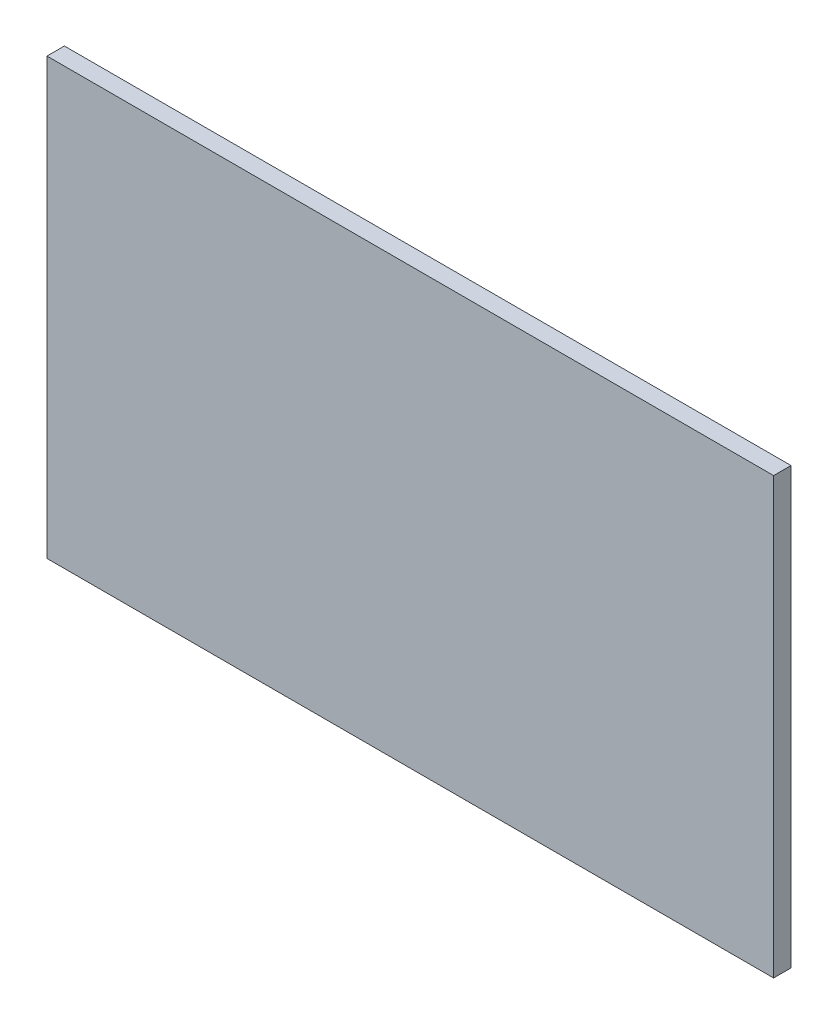
from build123d import *

# Parameters (mm, degrees)
SKETCH1_W           = 835
SKETCH1_H           = 500
BOSS_EXTRUDE1_DEPTH = 20


with BuildPart() as part:
    # Sketch1 → Boss-Extrude1 (new body)
    with BuildSketch(Plane.XY):
        Rectangle(SKETCH1_W, SKETCH1_H)
    extrude(amount=BOSS_EXTRUDE1_DEPTH)


solid = part.part
